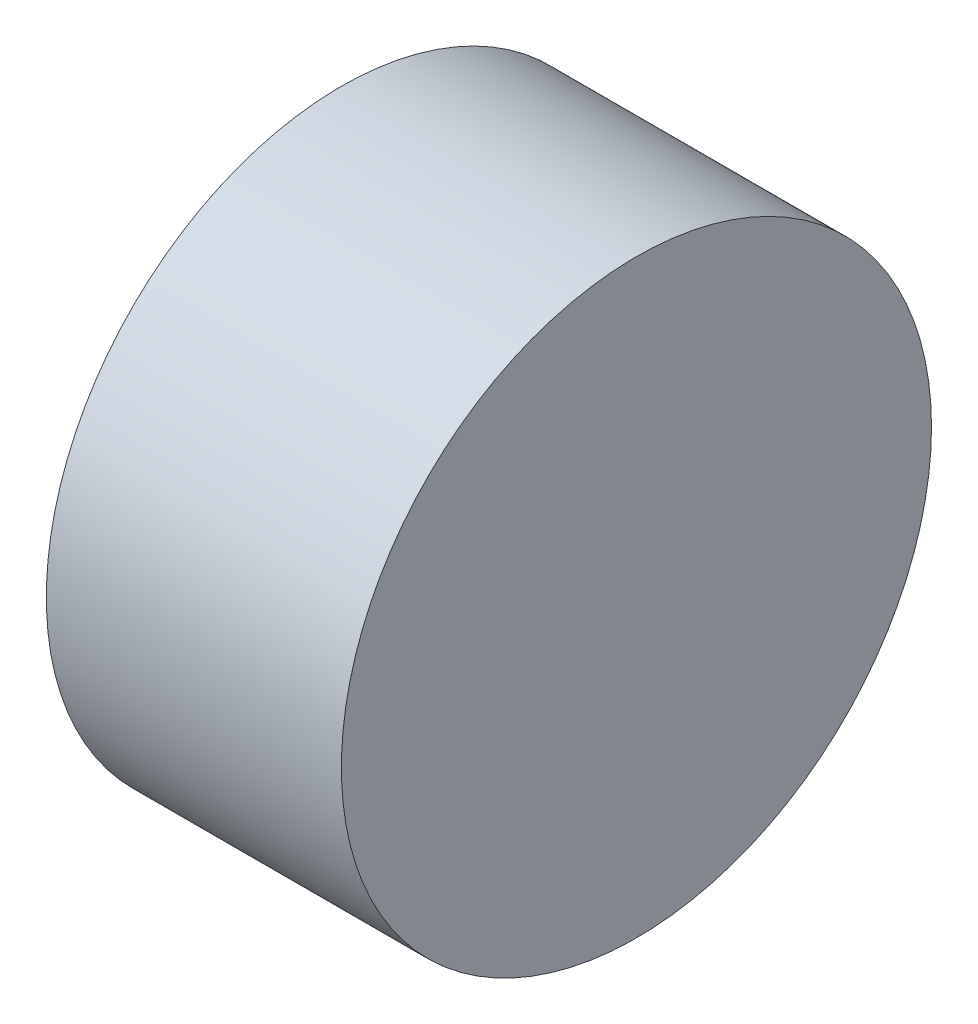
from build123d import *

# Parameters (mm, degrees)
SKETCH1_R           = 1
BOSS_EXTRUDE1_DEPTH = 1


with BuildPart() as part:
    # Sketch1 → Boss-Extrude1 (new body)
    with BuildSketch(Plane(origin=(0, 0, 0), x_dir=(0, 0, -1), z_dir=(1, 0, 0))):
        Circle(SKETCH1_R)
    extrude(amount=BOSS_EXTRUDE1_DEPTH)


solid = part.part
